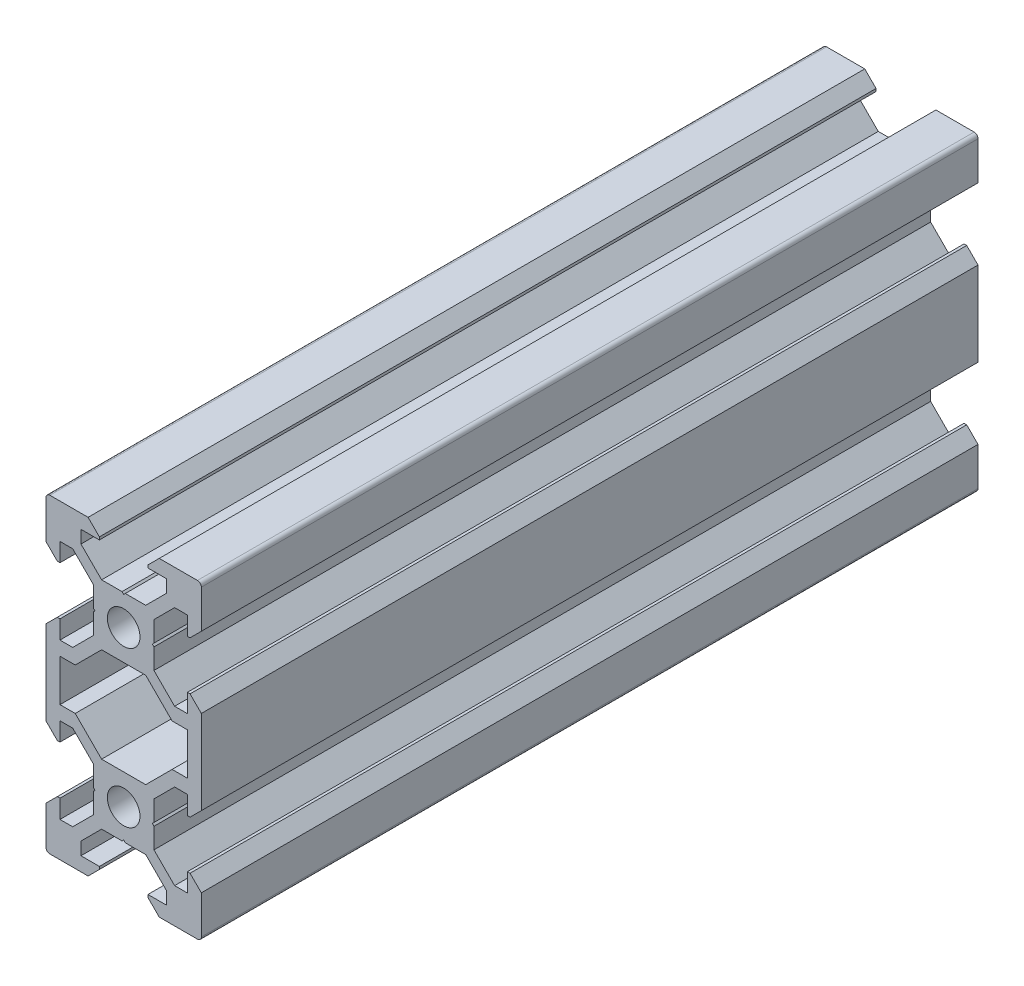
from build123d import *

# Parameters (mm, degrees)
SKETCH1_R           = 2.1
BOSS_EXTRUDE1_DEPTH = 100


with BuildPart() as part:
    # Sketch1 → Boss-Extrude1 (new body)
    with BuildSketch(Plane.XY.offset(500)):
        with BuildLine():
            Line((6.560660172, 4.5), (3.9, 7.160660172))
            Line((3.9, 7.160660172), (3.9, 9.79))
            Line((3.9, 9.79), (3.69, 10))
            Line((3.69, 10), (3.9, 10.21))
            Line((3.9, 10.21), (3.9, 12.839339828))
            Line((3.9, 12.839339828), (6.560660172, 15.5))
            Line((6.560660172, 15.5), (8.2, 15.5))
            Line((8.2, 15.5), (8.2, 13.125))
            Line((8.2, 13.125), (8.545, 13.125))
            Line((8.545, 13.125), (10, 14.58))
            Line((10, 14.58), (10, 19.5))
            ThreePointArc((10, 19.5), (9.853553391, 19.853553391), (9.5, 20))
            Line((9.5, 20), (4.58, 20))
            Line((4.58, 20), (3.125, 18.545))
            Line((3.125, 18.545), (3.125, 18.2))
            Line((3.125, 18.2), (5.5, 18.2))
            Line((5.5, 18.2), (5.5, 16.560660172))
            Line((5.5, 16.560660172), (2.839339828, 13.9))
            Line((2.839339828, 13.9), (0.21, 13.9))
            Line((0.21, 13.9), (0, 13.69))
            Line((0, 13.69), (-0.21, 13.9))
            Line((-0.21, 13.9), (-2.839339828, 13.9))
            Line((-2.839339828, 13.9), (-5.5, 16.560660172))
            Line((-5.5, 16.560660172), (-5.5, 18.2))
            Line((-5.5, 18.2), (-3.125, 18.2))
            Line((-3.125, 18.2), (-3.125, 18.545))
            Line((-3.125, 18.545), (-4.58, 20))
            Line((-4.58, 20), (-9.5, 20))
            ThreePointArc((-9.5, 20), (-9.853553391, 19.853553391), (-10, 19.5))
            Line((-10, 19.5), (-10, 14.58))
            Line((-10, 14.58), (-8.545, 13.125))
            Line((-8.545, 13.125), (-8.2, 13.125))
            Line((-8.2, 13.125), (-8.2, 15.5))
            Line((-8.2, 15.5), (-6.560660172, 15.5))
            Line((-6.560660172, 15.5), (-3.9, 12.839339828))
            Line((-3.9, 12.839339828), (-3.9, 10.21))
            Line((-3.9, 10.21), (-3.69, 10))
            Line((-3.69, 10), (-3.9, 9.79))
            Line((-3.9, 9.79), (-3.9, 7.160660172))
            Line((-3.9, 7.160660172), (-6.560660172, 4.5))
            Line((-6.560660172, 4.5), (-8.2, 4.5))
            Line((-8.2, 4.5), (-8.2, 6.875))
            Line((-8.2, 6.875), (-8.545, 6.875))
            Line((-8.545, 6.875), (-10, 5.42))
            Line((-10, 5.42), (-10, -5.42))
            Line((-10, -5.42), (-8.545, -6.875))
            Line((-8.545, -6.875), (-8.2, -6.875))
            Line((-8.2, -6.875), (-8.2, -4.5))
            Line((-8.2, -4.5), (-6.560660172, -4.5))
            Line((-6.560660172, -4.5), (-3.9, -7.160660172))
            Line((-3.9, -7.160660172), (-3.9, -9.79))
            Line((-3.9, -9.79), (-3.69, -10))
            Line((-3.69, -10), (-3.9, -10.21))
            Line((-3.9, -10.21), (-3.9, -12.839339828))
            Line((-3.9, -12.839339828), (-6.560660172, -15.5))
            Line((-6.560660172, -15.5), (-8.2, -15.5))
            Line((-8.2, -15.5), (-8.2, -13.125))
            Line((-8.2, -13.125), (-8.545, -13.125))
            Line((-8.545, -13.125), (-10, -14.58))
            Line((-10, -14.58), (-10, -19.5))
            ThreePointArc((-10, -19.5), (-9.853553391, -19.853553391), (-9.5, -20))
            Line((-9.5, -20), (-4.58, -20))
            Line((-4.58, -20), (-3.125, -18.545))
            Line((-3.125, -18.545), (-3.125, -18.2))
            Line((-3.125, -18.2), (-5.5, -18.2))
            Line((-5.5, -18.2), (-5.5, -16.560660172))
            Line((-5.5, -16.560660172), (-2.839339828, -13.9))
            Line((-2.839339828, -13.9), (-0.21, -13.9))
            Line((-0.21, -13.9), (0, -13.69))
            Line((0, -13.69), (0.21, -13.9))
            Line((0.21, -13.9), (2.839339828, -13.9))
            Line((2.839339828, -13.9), (5.5, -16.560660172))
            Line((5.5, -16.560660172), (5.5, -18.2))
            Line((5.5, -18.2), (3.125, -18.2))
            Line((3.125, -18.2), (3.125, -18.545))
            Line((3.125, -18.545), (4.58, -20))
            Line((4.58, -20), (9.5, -20))
            ThreePointArc((9.5, -20), (9.853553391, -19.853553391), (10, -19.5))
            Line((10, -19.5), (10, -14.58))
            Line((10, -14.58), (8.545, -13.125))
            Line((8.545, -13.125), (8.2, -13.125))
            Line((8.2, -13.125), (8.2, -15.5))
            Line((8.2, -15.5), (6.560660172, -15.5))
            Line((6.560660172, -15.5), (3.9, -12.839339828))
            Line((3.9, -12.839339828), (3.9, -10.21))
            Line((3.9, -10.21), (3.69, -10))
            Line((3.69, -10), (3.9, -9.79))
            Line((3.9, -9.79), (3.9, -7.160660172))
            Line((3.9, -7.160660172), (6.560660172, -4.5))
            Line((6.560660172, -4.5), (8.2, -4.5))
            Line((8.2, -4.5), (8.2, -6.875))
            Line((8.2, -6.875), (8.545, -6.875))
            Line((8.545, -6.875), (10, -5.42))
            Line((10, -5.42), (10, 5.42))
            Line((10, 5.42), (8.545, 6.875))
            Line((8.545, 6.875), (8.2, 6.875))
            Line((8.2, 6.875), (8.2, 4.5))
            Line((8.2, 4.5), (6.560660172, 4.5))
        make_face()
        with Locations(Location((0, 10, 0), (0, 0, 180))):
            Circle(SKETCH1_R, mode=Mode.SUBTRACT)
        with Locations(Location((0, -10, 0), (0, 0, 180))):
            Circle(SKETCH1_R, mode=Mode.SUBTRACT)
        Polygon((2.839339828, -6.1), (-2.839339828, -6.1), (-6.239339828, -2.7), (-8.2, -2.7), (-8.2, 2.7), (-6.239339828, 2.7), (-2.839339828, 6.1), (2.839339828, 6.1), (6.239339828, 2.7), (8.2, 2.7), (8.2, -2.7), (6.239339828, -2.7), align=None, mode=Mode.SUBTRACT)
    extrude(amount=-BOSS_EXTRUDE1_DEPTH)


solid = part.part
